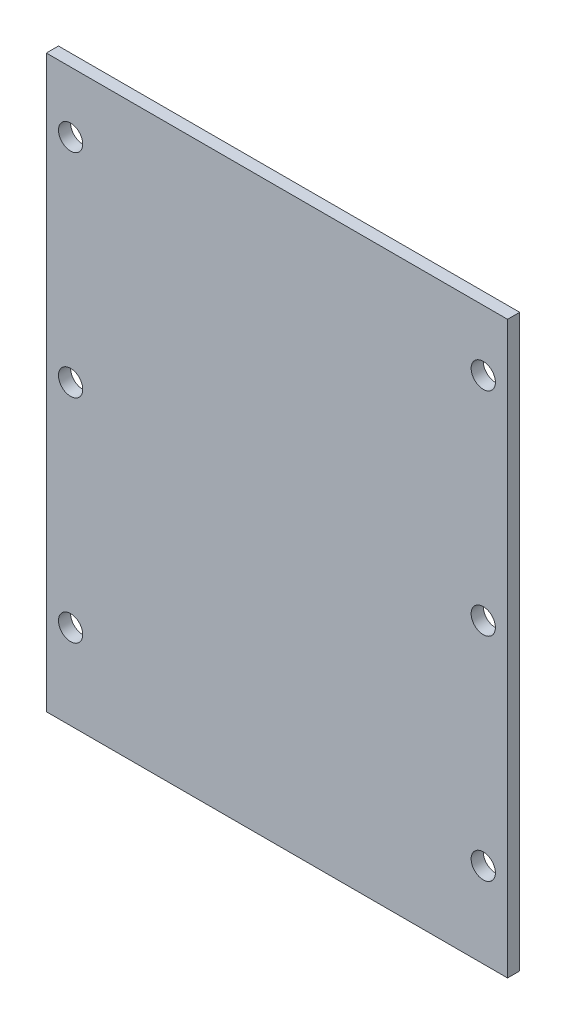
from build123d import *

# Parameters (mm, degrees)
SZKIC1_W                    = 76
SZKIC1_H                    = 94
DODANIE_WYCI_GNI_CIE1_DEPTH = 2
SZKIC2_R                    = 2
WYTNIJ_WYCI_GNI_CIE1_DEPTH  = 2


with BuildPart() as part:
    # Szkic1 → Dodanie-wyciągnięcie1 (new body)
    with BuildSketch(Plane.XY):
        Rectangle(SZKIC1_W, SZKIC1_H)
    extrude(amount=DODANIE_WYCI_GNI_CIE1_DEPTH)

    # Szkic2 → Wytnij-wyciągnięcie1 (cut)
    with BuildSketch(Plane.XY.offset(2)):
        with Locations((34, 37)):
            Circle(SZKIC2_R)
        with Locations((34, 2)):
            Circle(SZKIC2_R)
        with Locations((34, -33)):
            Circle(SZKIC2_R)
        with Locations((-34, -33)):
            Circle(SZKIC2_R)
        with Locations((-34, 2)):
            Circle(SZKIC2_R)
        with Locations((-34, 37)):
            Circle(SZKIC2_R)
    extrude(amount=-WYTNIJ_WYCI_GNI_CIE1_DEPTH, mode=Mode.SUBTRACT)


solid = part.part
